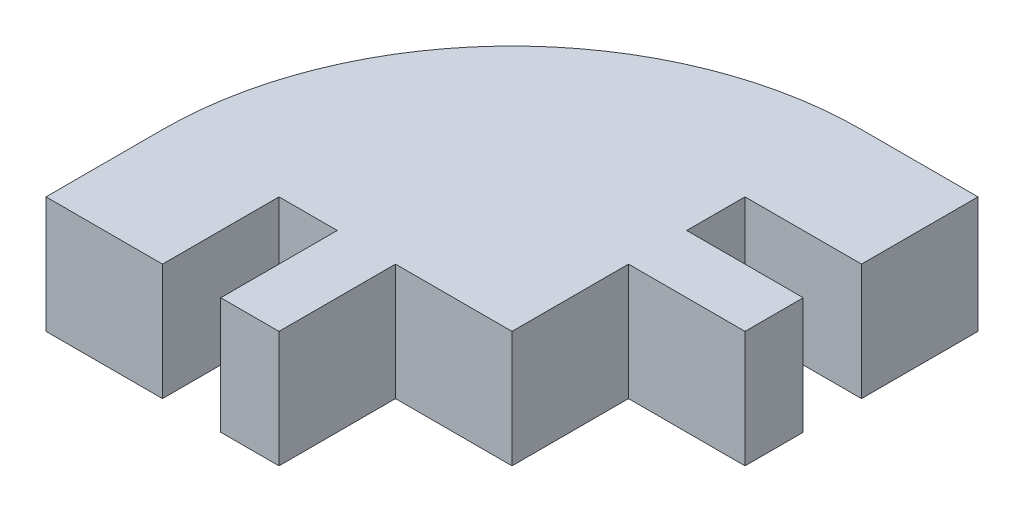
from build123d import *

# Parameters (mm, degrees)
SKETCH1_R                = 8
SKETCH1_R_2              = 4
BOSS_EXTRUDE1_DEPTH      = 9
BOSS_EXTRUDE1_2_DEPTH    = 9
SKETCH2_R                = 4
BOSS_EXTRUDE3_DEPTH      = 9
FILLET1_R                = 1
CUT_EXTRUDE1_DEPTH       = 214.789616212
SKETCH4_W                = 9
SKETCH4_H                = 27
BOSS_EXTRUDE4_DEPTH      = 75
BOSS_EXTRUDE5_START      = 9
SKETCH5_R                = 25
SKETCH5_R_2              = 4
BOSS_EXTRUDE5_DEPTH      = 9
BOSS_EXTRUDE6_DEPTH      = 4.5
BOSS_EXTRUDE6_DEPTH_BACK = 4.5
BOSS_EXTRUDE7_DEPTH      = 4.5
BOSS_EXTRUDE7_DEPTH_BACK = 4.5
BOSS_EXTRUDE7_START      = -25
SKETCH9_W                = 9
SKETCH9_H                = 7
SKETCH9_H_2              = 9
CUT_EXTRUDE2_DEPTH       = 217.612557346
CUT_EXTRUDE3_DEPTH       = 210.043655728
CUT_EXTRUDE3_DEPTH_BACK  = 210.043655728
SKETCH10_W               = 378.062868676
SKETCH10_H               = 121.353513402
SKETCH10_W_2             = 4.5
SKETCH10_H_2             = 9
SKETCH10_W_3             = 9
SKETCH10_H_3             = 4.5
CUT_EXTRUDE4_DEPTH       = 85.995588121
CUT_EXTRUDE4_DEPTH_BACK  = 85.995588121
SKETCH11_W               = 41.044011783
SKETCH11_H               = 27.30816427
SKETCH11_H_2             = 47.722771097


with BuildPart() as part:
    # Sketch1 → Boss-Extrude1 (new body)
    with BuildSketch(Plane.XY):
        with Locations((-125, 0)):
            Circle(SKETCH1_R)
        with Locations((-125, 0)):
            Circle(SKETCH1_R_2, mode=Mode.SUBTRACT)
    extrude(amount=BOSS_EXTRUDE1_DEPTH)



with BuildPart() as body_2:
    # Sketch1 → Boss-Extrude1 2 (new body)
    with BuildSketch(Plane.XY):
        with Locations((125, 0)):
            Circle(SKETCH1_R)
        with Locations((125, 0)):
            Circle(SKETCH1_R_2, mode=Mode.SUBTRACT)
    extrude(amount=BOSS_EXTRUDE1_2_DEPTH)


with BuildPart() as part_1:
    add(part.part)

    add(body_2.part)  # Boss-Extrude3 merges body 2
    # Sketch2 → Boss-Extrude3 (add)
    with BuildSketch(Plane.XY):
        with BuildLine():
            Line((-175, -75), (125, -75))
            ThreePointArc((125, -75), (130.131670325, -43.377223009), (145.000000492, -14.999999344))
            ThreePointArc((145.000000492, -14.999999344), (143.981414944, 16.269784471), (113.235294528, 22.058823748))
            ThreePointArc((113.235294528, 22.058823748), (25.000000075, 0), (-63.235294395, 22.058823677))
            ThreePointArc((-63.235294395, 22.058823677), (-75.420498385, 24.996463372), (-87.499999896, 21.650635154))
            ThreePointArc((-87.499999896, 21.650635154), (-99.999999954, 18.301270189), (-112.500000024, 21.650635108))
            ThreePointArc((-112.500000024, 21.650635108), (-124.99999995, 25), (-137.49999989, 21.650635158))
            ThreePointArc((-137.49999989, 21.650635158), (-149.999999954, 18.301270189), (-162.50000003, 21.650635112))
            ThreePointArc((-162.50000003, 21.650635112), (-193.705072901, 16.586749162), (-195.000000551, -14.999999265))
            ThreePointArc((-195.000000551, -14.999999265), (-180.13167034, -43.377222962), (-175, -75))
        make_face()
        with Locations((125, 0)):
            Circle(SKETCH2_R, mode=Mode.SUBTRACT)
        with Locations((-175, 0)):
            Circle(SKETCH2_R, mode=Mode.SUBTRACT)
        with Locations((-125, 0)):
            Circle(SKETCH2_R, mode=Mode.SUBTRACT)
        with Locations((-75, 0)):
            Circle(SKETCH2_R, mode=Mode.SUBTRACT)
    extrude(amount=BOSS_EXTRUDE3_DEPTH)

    # Fillet1
    fillet1_edges = [part_1.edges().sort_by_distance(p)[0] for p in [
        (-175, -75, 4.5),
        (125, -75, 4.5),
    ]]
    fillet(fillet1_edges, radius=FILLET1_R)

    # Sketch3 → Cut-Extrude1 (cut, through all)
    with BuildSketch(Plane.XY):
        Polygon((25, 0), (25, -75), (150, -75), (150, 25), (25, 25), align=None)
    extrude(amount=CUT_EXTRUDE1_DEPTH, mode=Mode.SUBTRACT)

    # Sketch4 → Boss-Extrude4 (add)
    with BuildSketch(Plane.XZ.offset(75)):
        with Locations((25, -4.5)):
            Rectangle(SKETCH4_W, SKETCH4_H)
    extrude(amount=-BOSS_EXTRUDE4_DEPTH)

    # Sketch5 → Boss-Extrude5 (add)
    # profile 1 of 4: a face of its own
    with BuildSketch(Plane(origin=(0, 0, -18), x_dir=(-1, 0, 0), z_dir=(0, 0, -1)).offset(BOSS_EXTRUDE5_START)):
        with BuildLine():
            ThreePointArc((-145.000000304, -14.999999594), (-130.131670275, -43.377223158), (-125, -75))
            Line((-125, -75), (-29.5, -75))
            Line((-29.5, -75), (-29.5, 0))
            Line((-29.5, 0), (-100, 0))
            ThreePointArc((-100, 0), (-117.09430609, -23.717082532), (-145.000000304, -14.999999594))
        make_face()
    # profile 2 of 4: a face of its own
    with BuildSketch(Plane(origin=(0, 0, -18), x_dir=(-1, 0, 0), z_dir=(0, 0, -1)).offset(BOSS_EXTRUDE5_START)):
        with Locations((-125, 0)):
            Circle(SKETCH5_R)
        with Locations((-125, 0)):
            Circle(SKETCH5_R_2, mode=Mode.SUBTRACT)
    # profile 3 of 4: a face of its own
    with BuildSketch(Plane(origin=(0, 0, -18), x_dir=(-1, 0, 0), z_dir=(0, 0, -1)).offset(BOSS_EXTRUDE5_START)):
        Polygon((-29.5, 0), (-29.5, -75), (-20.5, -75), (-20.5, 0), (-25, 0), align=None)
    # profile 4 of 4: a face of its own
    with BuildSketch(Plane(origin=(0, 0, -18), x_dir=(-1, 0, 0), z_dir=(0, 0, -1)).offset(BOSS_EXTRUDE5_START)):
        with BuildLine():
            Line((-100, 0), (-29.5, 0))
            Line((-29.5, 0), (-25, 0))
            ThreePointArc((-25, 0), (-70.475429529, 5.598281181), (-113.235293817, 22.058823369))
            ThreePointArc((-113.235293817, 22.058823369), (-103.56267677, 12.86239374), (-100, 0))
        make_face()
    extrude(amount=-BOSS_EXTRUDE5_DEPTH)

    # Sketch7 → Boss-Extrude6 (add, two sides: drawn at the far end of the back side and taken through both)
    with BuildSketch(Plane(origin=(0, -25, 0), x_dir=(1, 0, 0), z_dir=(0, 1, 0)).offset(-BOSS_EXTRUDE6_DEPTH_BACK)):
        with BuildLine():
            Line((56.5, 18), (29.5, 18))
            Line((29.5, 18), (29.5, -9))
            ThreePointArc((29.5, -9), (48.591883092, -1.091883092), (56.5, 18))
        make_face()
        with BuildLine():
            Line((-6.5, 0), (20.5, 0))
            Line((20.5, 0), (20.5, 27))
            ThreePointArc((20.5, 27), (1.408116908, 19.091883092), (-6.5, 0))
        make_face()
    extrude(amount=BOSS_EXTRUDE6_DEPTH + BOSS_EXTRUDE6_DEPTH_BACK)

    # Sketch7<3> → Boss-Extrude7 (add, two sides: drawn at the far end of the back side and taken through both)
    with BuildSketch(Plane(origin=(0, -25, 0), x_dir=(1, 0, 0), z_dir=(0, 1, 0)).offset(BOSS_EXTRUDE7_START - BOSS_EXTRUDE7_DEPTH_BACK)):
        with BuildLine():
            Line((56.5, 18), (29.5, 18))
            Line((29.5, 18), (29.5, -9))
            ThreePointArc((29.5, -9), (48.591883092, -1.091883092), (56.5, 18))
        make_face()
        with BuildLine():
            Line((-6.5, 0), (20.5, 0))
            Line((20.5, 0), (20.5, 27))
            ThreePointArc((20.5, 27), (1.408116908, 19.091883092), (-6.5, 0))
        make_face()
    extrude(amount=BOSS_EXTRUDE7_DEPTH + BOSS_EXTRUDE7_DEPTH_BACK)

    # Sketch9 → Cut-Extrude2 (cut, through all)
    with BuildSketch(Plane.XY.offset(9)):
        with Locations((-160.208548161, -53.5)):
            Rectangle(SKETCH9_W, SKETCH9_H)
        with Locations((-160.208548161, -70.5)):
            Rectangle(SKETCH9_W, SKETCH9_H_2)
        with Locations((-25.351798772, -53.5)):
            Rectangle(SKETCH9_W, SKETCH9_H)
        with Locations((-25.351798772, -70.5)):
            Rectangle(SKETCH9_W, SKETCH9_H_2)
        with Locations((109.504950616, -53.5)):
            Rectangle(SKETCH9_W, SKETCH9_H)
        with Locations((109.504950616, -70.5)):
            Rectangle(SKETCH9_W, SKETCH9_H_2)
    extrude(amount=-CUT_EXTRUDE2_DEPTH, mode=Mode.SUBTRACT)

    # Sketch10 → Cut-Extrude3 (cut, two sides: drawn at the far end of the back side and taken through both)
    # profile 1 of 11: a face of its own
    with BuildSketch(Plane(origin=(0, -20.5, 0), x_dir=(1, 0, 0), z_dir=(0, 1, 0)).offset(-CUT_EXTRUDE3_DEPTH_BACK)):
        with Locations((-22.824558852, 8.698613075)):
            Rectangle(SKETCH10_W, SKETCH10_H)
        with BuildLine():
            ThreePointArc((-6.5, 0), (-4.122805694, 11.077790383), (2.590180724, 20.204909638))
            ThreePointArc((2.590180724, 20.204909638), (30.603376531, 44.977445399), (56.5, 18))
            ThreePointArc((56.5, 18), (54.122805694, 6.922209617), (47.409819276, -2.204909638))
            ThreePointArc((47.409819276, -2.204909638), (23.974453078, -26.775514483), (-4.955844123, -9))
            Line((-4.955844123, -9), (-6.5, -9))
            Line((-6.5, -9), (-6.5, 0))
        make_face(mode=Mode.SUBTRACT)
    # profile 2 of 11: a face of its own
    with BuildSketch(Plane(origin=(0, -20.5, 0), x_dir=(1, 0, 0), z_dir=(0, 1, 0)).offset(-CUT_EXTRUDE3_DEPTH_BACK)):
        with BuildLine():
            ThreePointArc((47.5, 0), (42.545407685, 15.588457268), (29.5, 25.455844123))
            Line((29.5, 25.455844123), (29.5, 18))
            Line((29.5, 18), (29.5, 13.5))
            Line((29.5, 13.5), (29.5, 9))
            Line((29.5, 9), (29.5, 4.5))
            Line((29.5, 4.5), (29.5, 0))
            Line((29.5, 0), (29.5, -9))
            ThreePointArc((29.5, -9), (39.077772178, -7.244133578), (47.409819276, -2.204909638))
            ThreePointArc((47.409819276, -2.204909638), (47.477445399, -1.103376531), (47.5, 0))
        make_face()
    # profile 3 of 11: a face of its own
    with BuildSketch(Plane(origin=(0, -20.5, 0), x_dir=(1, 0, 0), z_dir=(0, 1, 0)).offset(-CUT_EXTRUDE3_DEPTH_BACK)):
        with BuildLine():
            ThreePointArc((2.590180724, 20.204909638), (10.922227822, 25.244133578), (20.5, 27))
            Line((20.5, 27), (29.5, 27))
            Line((29.5, 27), (29.5, 25.455844123))
            ThreePointArc((29.5, 25.455844123), (42.545407685, 15.588457268), (47.5, 0))
            ThreePointArc((47.5, 0), (47.477445399, -1.103376531), (47.409819276, -2.204909638))
            ThreePointArc((47.409819276, -2.204909638), (54.122805694, 6.922209617), (56.5, 18))
            ThreePointArc((56.5, 18), (30.603376531, 44.977445399), (2.590180724, 20.204909638))
        make_face()
    # profile 4 of 11: a face of its own
    with BuildSketch(Plane(origin=(0, -20.5, 0), x_dir=(1, 0, 0), z_dir=(0, 1, 0)).offset(-CUT_EXTRUDE3_DEPTH_BACK)):
        with Locations((4.75, -4.5)):
            Rectangle(SKETCH10_W_2, SKETCH10_H_2)
    # profile 5 of 11: a face of its own
    with BuildSketch(Plane(origin=(0, -20.5, 0), x_dir=(1, 0, 0), z_dir=(0, 1, 0)).offset(-CUT_EXTRUDE3_DEPTH_BACK)):
        with Locations((25, 15.75)):
            Rectangle(SKETCH10_W_3, SKETCH10_H_3)
    # profile 6 of 11: a face of its own
    with BuildSketch(Plane(origin=(0, -20.5, 0), x_dir=(1, 0, 0), z_dir=(0, 1, 0)).offset(-CUT_EXTRUDE3_DEPTH_BACK)):
        with Locations((25, 6.75)):
            Rectangle(SKETCH10_W_3, SKETCH10_H_3)
    # profile 7 of 11: a face of its own
    with BuildSketch(Plane(origin=(0, -20.5, 0), x_dir=(1, 0, 0), z_dir=(0, 1, 0)).offset(-CUT_EXTRUDE3_DEPTH_BACK)):
        with Locations((25, 2.25)):
            Rectangle(SKETCH10_W_3, SKETCH10_H_3)
    # profile 8 of 11: a face of its own
    with BuildSketch(Plane(origin=(0, -20.5, 0), x_dir=(1, 0, 0), z_dir=(0, 1, 0)).offset(-CUT_EXTRUDE3_DEPTH_BACK)):
        with BuildLine():
            Line((20.5, 0), (11.5, 0))
            Line((11.5, 0), (11.5, -2.124611797))
            ThreePointArc((11.5, -2.124611797), (15.739349233, -5.230249471), (20.5, -7.455844123))
            Line((20.5, -7.455844123), (20.5, 0))
        make_face()
    # profile 9 of 11: a face of its own
    with BuildSketch(Plane(origin=(0, -20.5, 0), x_dir=(1, 0, 0), z_dir=(0, 1, 0)).offset(-CUT_EXTRUDE3_DEPTH_BACK)):
        with BuildLine():
            ThreePointArc((20.5, -7.455844123), (15.739349233, -5.230249471), (11.5, -2.124611797))
            Line((11.5, -2.124611797), (11.5, -9))
            Line((11.5, -9), (20.5, -9))
            Line((20.5, -9), (20.5, -7.455844123))
        make_face()
    # profile 10 of 11: a face of its own
    with BuildSketch(Plane(origin=(0, -20.5, 0), x_dir=(1, 0, 0), z_dir=(0, 1, 0)).offset(-CUT_EXTRUDE3_DEPTH_BACK)):
        with BuildLine():
            Line((20.5, -9), (29.5, -9))
            ThreePointArc((29.5, -9), (24.934246574, -8.611161111), (20.5, -7.455844123))
            Line((20.5, -7.455844123), (20.5, -9))
        make_face()
    # profile 11 of 11: a face of its own
    with BuildSketch(Plane(origin=(0, -20.5, 0), x_dir=(1, 0, 0), z_dir=(0, 1, 0)).offset(-CUT_EXTRUDE3_DEPTH_BACK)):
        with BuildLine():
            ThreePointArc((20.5, -7.455844123), (24.934246574, -8.611161111), (29.5, -9))
            Line((29.5, -9), (29.5, 0))
            Line((29.5, 0), (20.5, 0))
            Line((20.5, 0), (20.5, -7.455844123))
        make_face()
    extrude(amount=CUT_EXTRUDE3_DEPTH + CUT_EXTRUDE3_DEPTH_BACK, mode=Mode.SUBTRACT)

    # Sketch11 → Cut-Extrude4 (cut, two sides: drawn at the far end of the back side and taken through both)
    with BuildSketch(Plane.XY.offset(-CUT_EXTRUDE4_DEPTH_BACK)):
        with Locations((11.617711519, -6.845917865)):
            Rectangle(SKETCH11_W, SKETCH11_H)
        with Locations((11.617711519, -53.361385549)):
            Rectangle(SKETCH11_W, SKETCH11_H_2)
    extrude(amount=CUT_EXTRUDE4_DEPTH + CUT_EXTRUDE4_DEPTH_BACK, mode=Mode.SUBTRACT)


solid = part_1.part
